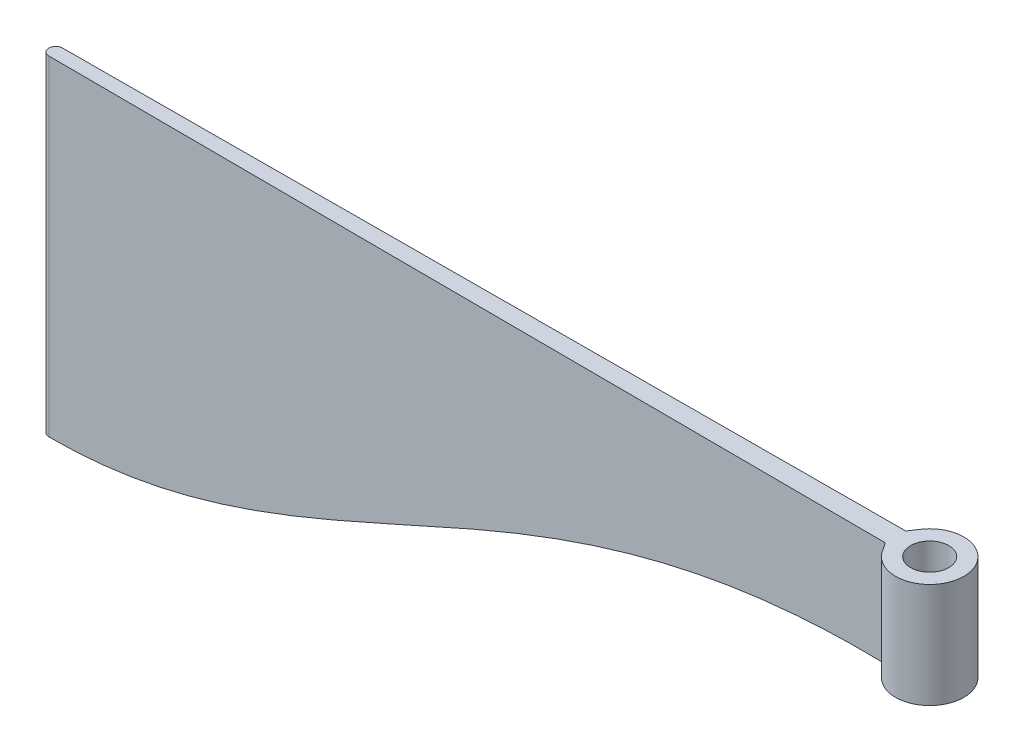
from build123d import *

# Parameters (mm, degrees)
Y_KSEKLIK_EKSTR_ZYON1_DEPTH = 3
Y_KSEKLIK_EKSTR_ZYON3_DEPTH = 15.352247347
KES_EKSTR_ZYON6_DEPTH       = 83.869457244
RADYUS1_R                   = 1
IZIM9_R                     = 2.8
KES_EKSTR_ZYON7_DEPTH       = 13


with BuildPart() as part:
    # Çizim1 → Yükseklik-Ekstrüzyon1 (new body)
    with BuildSketch(Plane.XY):
        with BuildLine():
            Line((51.744165627, 14.308045798), (56.895737739, 14.308045798))
            Line((56.895737739, 14.308045798), (56.895737739, 29.660293145))
            Line((56.895737739, 29.660293145), (-67.032214562, 29.660293145))
            Line((-67.032214562, 29.660293145), (-67.032214562, -18.6200596))
            add(Edge.make_bspline(
                [(51.744165627, 14.308045798), (32.353014477, 13.942055171), (-5.53549701, 3.029288221), (-42.761336594, -18.994069798), (-67.032214562, -18.6200596)],
                knots=[0, 0, 0, 0, 0.428556307, 1, 1, 1, 1], degree=3))
        make_face()
    extrude(amount=Y_KSEKLIK_EKSTR_ZYON1_DEPTH)

    # Çizim5 → Yükseklik-Ekstrüzyon3 (add)
    with BuildSketch(Plane(origin=(0, 29.660293145, 0), x_dir=(1, 0, 0), z_dir=(0, 1, 0))):
        with BuildLine():
            Line((57.574880058, 1.015986664), (56.895737739, 0))
            Line((56.895737739, 0), (56.895737739, -3))
            Line((56.895737739, -3), (57.574880058, -4.015986664))
            Line((57.574880058, -4.015986664), (57.918910072, -4.530650376))
            ThreePointArc((57.918910072, -4.530650376), (66.895737739, -1.5), (57.918910072, 1.530650376))
            Line((57.918910072, 1.530650376), (57.574880058, 1.015986664))
        make_face()
    extrude(amount=-Y_KSEKLIK_EKSTR_ZYON3_DEPTH)

    # Çizim7 → Kes-Ekstrüzyon6 (cut, through all)
    with BuildSketch(Plane(origin=(0, 29.660293145, 0), x_dir=(1, 0, 0), z_dir=(0, 1, 0))):
        Polygon((-67.032214562, -0.5), (56.895737739, 0), (-67.032214562, 0), align=None)
        Polygon((-67.032214562, -3), (56.895737739, -3), (-67.032214562, -2.5), align=None)
    extrude(amount=-KES_EKSTR_ZYON6_DEPTH, mode=Mode.SUBTRACT)

    # Radyus1
    radyus1_edges = [part.edges().sort_by_distance(p)[0] for p in [
        (-67.032214562, 5.520116772, 2.5),
        (-67.032214562, 5.520116772, 0.5),
    ]]
    fillet(radyus1_edges, radius=RADYUS1_R)

    # Çizim9 → Kes-Ekstrüzyon7 (cut)
    with BuildSketch(Plane(origin=(0, 29.660293145, 0), x_dir=(-1, 0, 0), z_dir=(0, 1, 0))):
        with Locations(Location((-61.895737739, 1.5, 0), (0, 0, 90))):
            Circle(IZIM9_R)
    extrude(amount=-KES_EKSTR_ZYON7_DEPTH, mode=Mode.SUBTRACT)


solid = part.part
